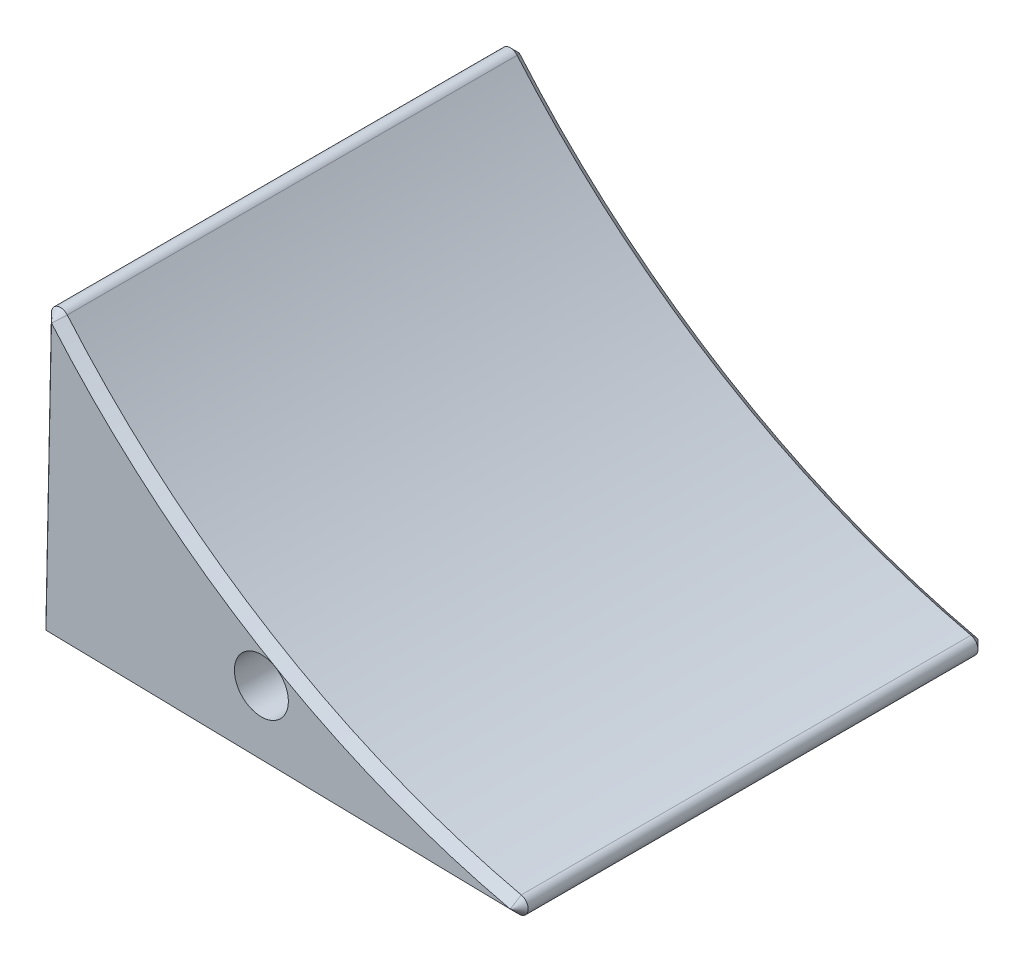
from build123d import *

# Parameters (mm, degrees)
EXTRUDE_1_DEPTH          = 26
CUT_EXTRUDE_1_DEPTH      = 249.953347952
CUT_EXTRUDE_1_DEPTH_BACK = 249.953347952
SKETCH_2_R               = 1.5
FILLET_1_R               = 0.5
CHAMFER_1_SIZE           = 0.5


with BuildPart() as part:
    # 草图1 → 凸台-拉伸1 (new body)
    with BuildSketch(Plane.XY):
        with BuildLine():
            Line((-212.180704616, 127.029942007), (-212.520971413, 110.249281361))
            Line((-212.520971413, 110.249281361), (-176.528370185, 109.519447931))
            ThreePointArc((-176.528370185, 109.519447931), (-196.295218168, 114.323361589), (-212.180704616, 127.029942007))
        make_face()
    extrude(amount=EXTRUDE_1_DEPTH)

    # 草图2 → 切除-拉伸1 (cut, two sides: drawn at the far end of the back side and taken through both)
    with BuildSketch(Plane(origin=(0, 0, 0), x_dir=(-1, 0, 0), z_dir=(0, 0, -1)).offset(-CUT_EXTRUDE_1_DEPTH_BACK)):
        with Locations((200.041202679, 114.05266186)):
            Circle(SKETCH_2_R)
    extrude(amount=CUT_EXTRUDE_1_DEPTH + CUT_EXTRUDE_1_DEPTH_BACK, mode=Mode.SUBTRACT)

    # 圆角1
    fillet_1_edges = [part.edges().sort_by_distance(p)[0] for p in [
        (-212.520971413, 110.249281361, 13),
        (-176.528370185, 109.519447931, 13),
        (-212.180704616, 127.029942007, 13),
    ]]
    fillet(fillet_1_edges, radius=FILLET_1_R)

    # 倒角1
    chamfer_1_edges = [part.edges().sort_by_distance(p)[0] for p in [
        (-199.945178972, 116.321228968, 26),
        (-199.945178972, 116.321228968, 0),
        (-199.121405734, 109.977574103, 0),
        (-212.359389005, 118.217909462, 0),
        (-212.371585967, 110.392728938, 0),
        (-211.876239308, 126.147365712, 0),
        (-185.71538147, 110.154529202, 0),
        (-199.121405734, 109.977574103, 26),
        (-212.359389005, 118.217909462, 26),
        (-212.371585967, 110.392728938, 26),
        (-211.876239308, 126.147365712, 26),
        (-185.71538147, 110.154529202, 26),
    ]]
    chamfer(chamfer_1_edges, length=CHAMFER_1_SIZE)


solid = part.part
